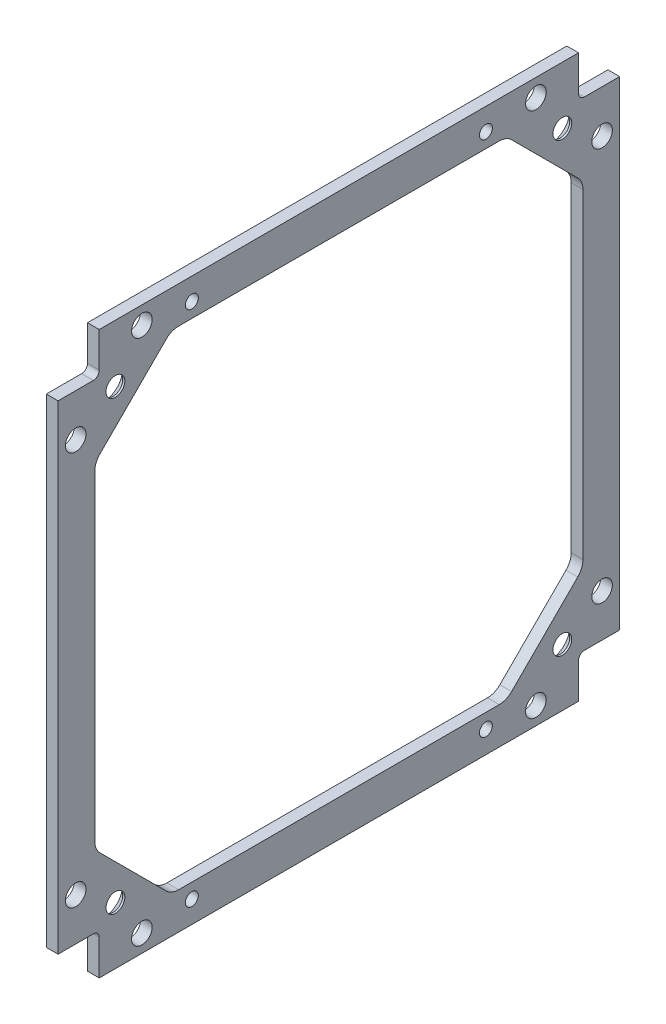
from build123d import *

# Parameters (mm, degrees)
BOSS_EXTRUDE2_DEPTH                          = 2
F_3_5_3_5_DIAMETER_HOLE1_D                   = 3.5
CSK_FOR_M3_FLAT_COUNTERSUNK_HEAD_SCR_2_COUNT = 2
CSK_FOR_M3_FLAT_COUNTERSUNK_HEAD_SCR_2_PITCH = 76
CSK_FOR_M3_FLAT_COUNTERSUNK_HEAD_SCR_3_COUNT = 2
CSK_FOR_M3_FLAT_COUNTERSUNK_HEAD_SCR_3_PITCH = 107.48023074
CSK_FOR_M3_FLAT_COUNTERSUNK_HEAD_SCR_4_COUNT = 2
CSK_FOR_M3_FLAT_COUNTERSUNK_HEAD_SCR_4_PITCH = 76
F_2_2_2_2_DIAMETER_HOLE1_D                   = 2.2
FILLET1_R                                    = 3
FILLET2_R                                    = 1


with BuildPart() as part:
    # Sketch2 → Boss-Extrude2 (new body)
    with BuildSketch(Plane.ZY.offset(51.493641502)):
        Polygon((0.43465612, 3.95185693), (7.43465612, 3.95185693), (7.43465612, 85.45185693), (0.43465612, 85.45185693), (0.43465612, 92.45185693), (-81.06534388, 92.45185693), (-81.06534388, 85.45185693), (-88.06534388, 85.45185693), (-88.06534388, 3.95185693), (-81.06534388, 3.95185693), (-81.06534388, -3.04814307), (0.43465612, -3.04814307), align=None)
        Polygon((-81.81534388, 73.20185693), (-81.81534388, 16.20185693), (-68.81534388, 3.20185693), (-11.81534388, 3.20185693), (1.18465612, 16.20185693), (1.18465612, 73.20185693), (-11.81534388, 86.20185693), (-68.81534388, 86.20185693), align=None, mode=Mode.SUBTRACT)
    extrude(amount=BOSS_EXTRUDE2_DEPTH)

    # Ø3.5 (3.5) Diameter Hole1 (through all)
    with Locations(Plane.ZY.offset(53.493641502)):
        with Locations((-73.81534388, -0.04814307), (-85.06534388, 11.20185693), (-85.06534388, 78.20185693), (-73.81534388, 89.45185693), (-6.81534388, 89.45185693), (4.43465612, 78.20185693), (4.43465612, 11.20185693), (-6.81534388, -0.04814307)):
            Hole(F_3_5_3_5_DIAMETER_HOLE1_D / 2)

    # Sketch24 → CSK for M3 Flat Countersunk Head Screw5 (revolve, cut)
    with BuildSketch(Plane(origin=(-53.493641502, 6.70185693, -78.31534388), x_dir=(0, 0, 1), z_dir=(0, 1, 0))):
        Polygon((0, 0), (0, 2), (1.6, 2), (1.6, 1.65), (3.25, 0), align=None)
    csk_for_m3_flat_countersunk_head_screw5 = revolve(axis=Axis((-59.843641502, 6.70185693, -78.31534388), (1, 0, 0)), mode=Mode.SUBTRACT)

    # CSK for M3 Flat Countersunk Head Scr 2: CSK for M3 Flat Countersunk Head Screw5 ×2
    with Locations(*[(0, i * CSK_FOR_M3_FLAT_COUNTERSUNK_HEAD_SCR_2_PITCH, 0) for i in range(1, CSK_FOR_M3_FLAT_COUNTERSUNK_HEAD_SCR_2_COUNT)]):
        add(csk_for_m3_flat_countersunk_head_screw5, mode=Mode.SUBTRACT)

    # CSK for M3 Flat Countersunk Head Scr 3: CSK for M3 Flat Countersunk Head Screw5 ×2
    with Locations(*[Vector(0, 0.7071067811865478, 0.7071067811865472) * (i * CSK_FOR_M3_FLAT_COUNTERSUNK_HEAD_SCR_3_PITCH) for i in range(1, CSK_FOR_M3_FLAT_COUNTERSUNK_HEAD_SCR_3_COUNT)]):
        add(csk_for_m3_flat_countersunk_head_screw5, mode=Mode.SUBTRACT)

    # CSK for M3 Flat Countersunk Head Scr 4: CSK for M3 Flat Countersunk Head Screw5 ×2
    with Locations(*[(0, 0, i * CSK_FOR_M3_FLAT_COUNTERSUNK_HEAD_SCR_4_PITCH) for i in range(1, CSK_FOR_M3_FLAT_COUNTERSUNK_HEAD_SCR_4_COUNT)]):
        add(csk_for_m3_flat_countersunk_head_screw5, mode=Mode.SUBTRACT)

    # Ø2.2 (2.2) Diameter Hole1 (through all)
    with Locations(Plane(origin=(-53.493641502, 88.70185693, -65.31534388), x_dir=(0, 0, -1), z_dir=(-1, 0, 0))):
        with Locations((0, 0), (-50, 0), (0, 88), (-50, 88)):
            Hole(F_2_2_2_2_DIAMETER_HOLE1_D / 2)

    # Fillet1
    fillet1_edges = [part.edges().sort_by_distance(p)[0] for p in [
        (-52.493641502, 86.20185693, -68.81534388),
        (-52.493641502, 73.20185693, -81.81534388),
        (-52.493641502, 16.20185693, -81.81534388),
        (-52.493641502, 3.20185693, -68.81534388),
        (-52.493641502, 3.20185693, -11.81534388),
        (-52.493641502, 16.20185693, 1.18465612),
        (-52.493641502, 73.20185693, 1.18465612),
        (-52.493641502, 86.20185693, -11.81534388),
    ]]
    fillet(fillet1_edges, radius=FILLET1_R)

    # Fillet2
    fillet2_edges = [part.edges().sort_by_distance(p)[0] for p in [
        (-52.493641502, 3.95185693, -81.06534388),
        (-52.493641502, 85.45185693, -81.06534388),
        (-52.493641502, 85.45185693, 0.43465612),
        (-52.493641502, 3.95185693, 0.43465612),
    ]]
    fillet(fillet2_edges, radius=FILLET2_R)


solid = part.part
